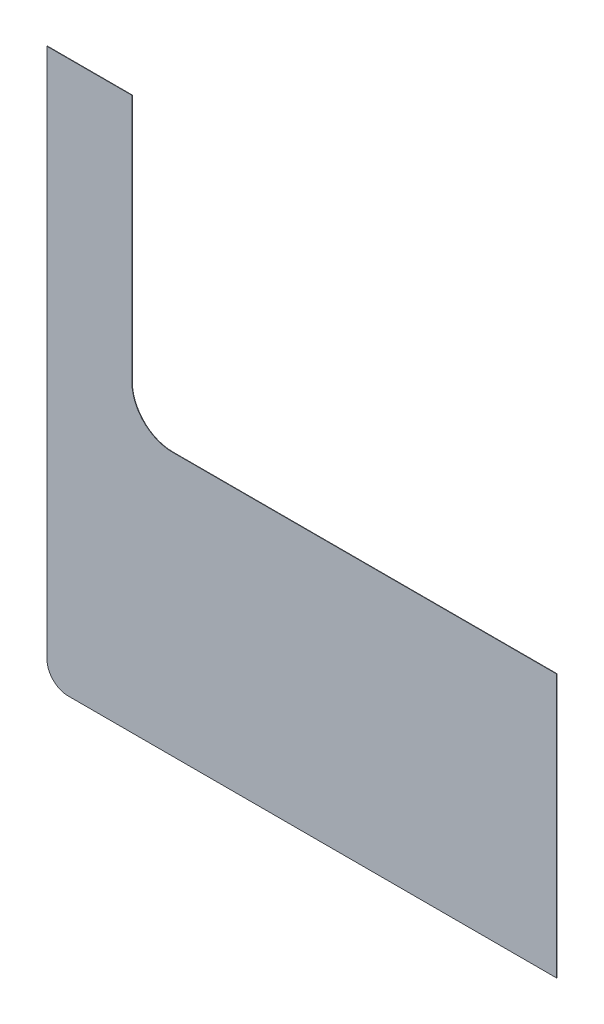
from build123d import *

# Parameters (mm, degrees)
EXTRUDE_1_DEPTH = 0.1
FILLET_1_R      = 9.5
FILLET_2_R      = 5


with BuildPart() as part:
    # 草图1 → 凸台-拉伸1 (new body)
    with BuildSketch(Plane.XY):
        Polygon((0, 0), (-120, 0), (-120, 130), (-100, 130), (-100, 62), (0, 62), align=None)
    extrude(amount=EXTRUDE_1_DEPTH)

    # 圆角1
    fillet_1_edges = [part.edges().sort_by_distance(p)[0] for p in [
        (-100, 62, 0.05),
    ]]
    fillet(fillet_1_edges, radius=FILLET_1_R)

    # 圆角2
    fillet_2_edges = [part.edges().sort_by_distance(p)[0] for p in [
        (-120, 0, 0.05),
    ]]
    fillet(fillet_2_edges, radius=FILLET_2_R)


solid = part.part
